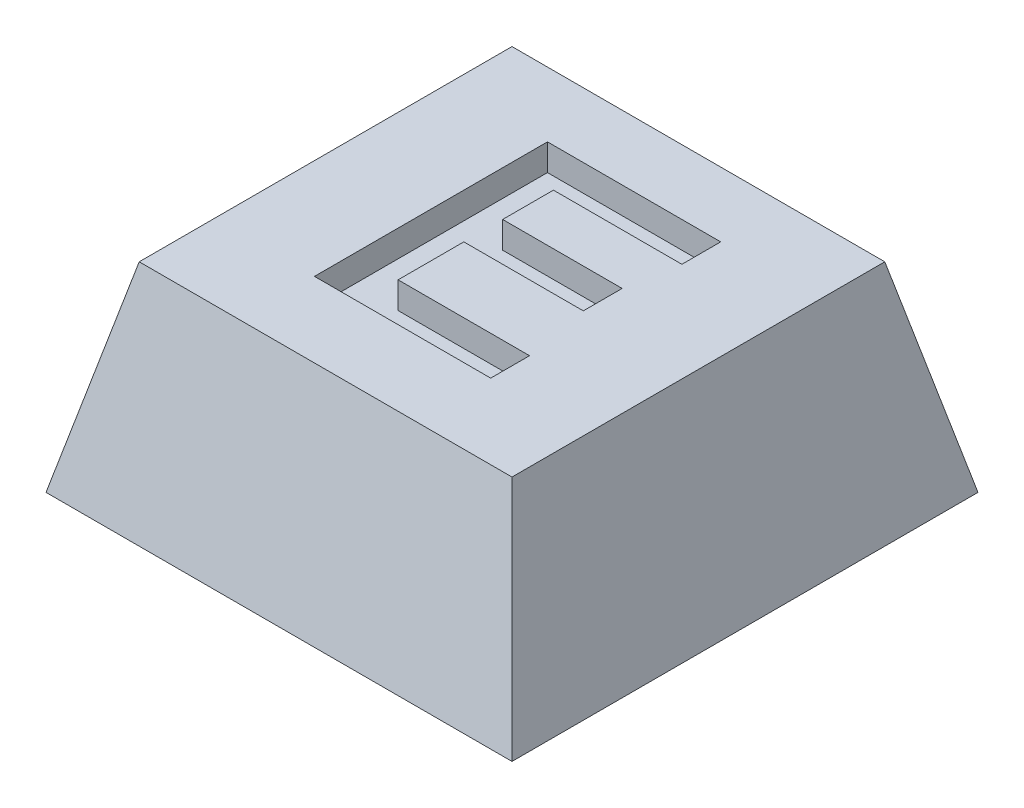
from build123d import *

# Parameters (mm, degrees)
SKETCH1_W           = 7
SKETCH1_H           = 7
BOSS_EXTRUDE1_DEPTH = 3
CUT_EXTRUDE1_DEPTH  = 7
CUT_EXTRUDE2_DEPTH  = 11
SKETCH4_R           = 1.8
CUT_EXTRUDE3_DEPTH  = 0.8
CUT_EXTRUDE4_DEPTH  = 0.4


with BuildPart() as part:
    # Sketch1 → Boss-Extrude1 (new body)
    with BuildSketch(Plane(origin=(0, 0, 0), x_dir=(1, 0, 0), z_dir=(0, 1, 0))):
        with Locations((3.5, 3.5)):
            Rectangle(SKETCH1_W, SKETCH1_H)
    extrude(amount=BOSS_EXTRUDE1_DEPTH)

    # Sketch2 → Cut-Extrude1 (cut)
    with BuildSketch(Plane.XY):
        Polygon((0, 0), (0.7, 3), (0, 3), align=None)
        Polygon((7, 0), (6.3, 3), (7, 3), align=None)
    extrude(amount=-CUT_EXTRUDE1_DEPTH, mode=Mode.SUBTRACT)

    # Sketch3 → Cut-Extrude2 (cut)
    with BuildSketch(Plane(origin=(0, 0, 0), x_dir=(0, 0, -1), z_dir=(1, 0, 0))):
        Polygon((0, 0), (0.7, 3), (0, 3), align=None)
        Polygon((7, 3), (6.3, 3), (7, 0), align=None)
    extrude(amount=CUT_EXTRUDE2_DEPTH, mode=Mode.SUBTRACT)

    # Sketch4 → Cut-Extrude3 (cut)
    with BuildSketch(Plane.XZ):
        with Locations(Location((3.5, -3.5, 0), (0, 0, 270))):
            Circle(SKETCH4_R)
    extrude(amount=-CUT_EXTRUDE3_DEPTH, mode=Mode.SUBTRACT)

    # Sketch5 → Cut-Extrude4 (cut)
    with BuildSketch(Plane(origin=(0, 3, 0), x_dir=(1, 0, 0), z_dir=(0, 1, 0))):
        Polygon((2.20596729, 1.826752028), (2.20596729, 5.326752028), (4.808531392, 5.326752028), (4.808531392, 4.743418695), (2.879044213, 4.743418695), (2.879044213, 3.980598182), (4.673916008, 3.980598182), (4.673916008, 3.397264848), (2.879044213, 3.397264848), (2.879044213, 2.410085361), (4.853403187, 2.410085361), (4.853403187, 1.826752028), align=None)
    extrude(amount=-CUT_EXTRUDE4_DEPTH, mode=Mode.SUBTRACT)


solid = part.part
